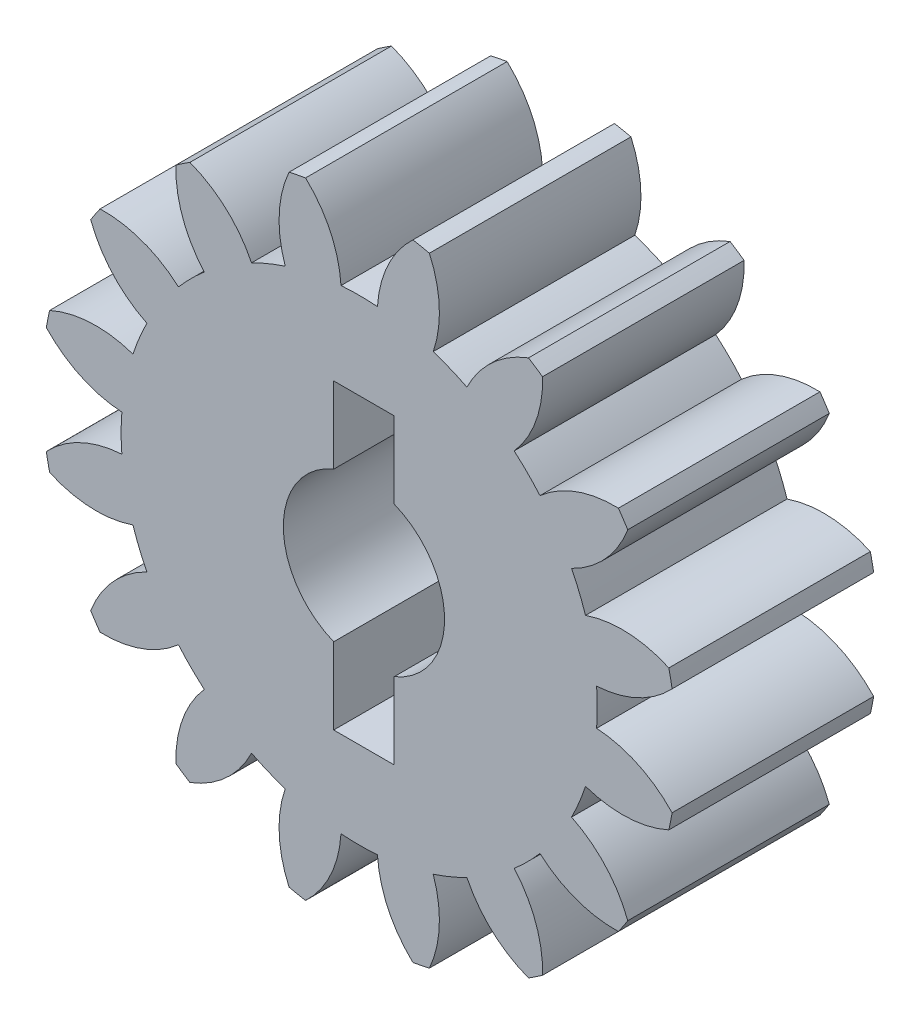
from build123d import *

# Parameters (mm, degrees)
BOSS_EXTRUDE1_DEPTH = 20


with BuildPart() as part:
    # Sketch1 → Boss-Extrude1 (new body)
    with BuildSketch(Plane.XY):
        with BuildLine():
            ThreePointArc((-31.51508502, 5.323636185), (-28.105369496, 2.849349951), (-24.022779405, 1.809777696))
            ThreePointArc((-24.022779405, 1.809777696), (-24.092202765, 0), (-24.022779405, -1.809777696))
            ThreePointArc((-24.022779405, -1.809777696), (-28.105369496, -2.849349951), (-31.51508502, -5.323636185))
            ThreePointArc((-31.51508502, -5.323636185), (-31.362939098, -6.145345144), (-31.189049197, -6.962728956))
            ThreePointArc((-31.189049197, -6.962728956), (-27.092014464, -7.943829725), (-22.92236596, -7.341929665))
            ThreePointArc((-22.92236596, -7.341929665), (-22.293932841, -9.040513406), (-21.537222079, -10.685962808))
            ThreePointArc((-21.537222079, -10.685962808), (-24.911216425, -13.208741926), (-27.114514461, -16.799525975))
            ThreePointArc((-27.114514461, -16.799525975), (-26.659495553, -17.50046234), (-26.186042989, -18.189081731))
            ThreePointArc((-26.186042989, -18.189081731), (-22.025425445, -17.527633336), (-18.403509716, -15.375894789))
            ThreePointArc((-18.403509716, -15.375894789), (-17.172893364, -16.704690599), (-15.844097554, -17.935306952))
            ThreePointArc((-15.844097554, -17.935306952), (-17.995836101, -21.55722268), (-18.657284496, -25.717840224))
            ThreePointArc((-18.657284496, -25.717840224), (-17.968665105, -26.191292788), (-17.26772874, -26.646311696))
            ThreePointArc((-17.26772874, -26.646311696), (-13.676944691, -24.44301366), (-11.154165573, -21.069019314))
            ThreePointArc((-11.154165573, -21.069019314), (-9.508716171, -21.825730076), (-7.81013243, -22.454163195))
            ThreePointArc((-7.81013243, -22.454163195), (-8.41203249, -26.623811699), (-7.430931721, -30.720846432))
            ThreePointArc((-7.430931721, -30.720846432), (-6.613547908, -30.894736333), (-5.79183895, -31.046882255))
            ThreePointArc((-5.79183895, -31.046882255), (-3.317552716, -27.637166731), (-2.277980461, -23.55457664))
            ThreePointArc((-2.277980461, -23.55457664), (-0.468202765, -23.624), (1.341574931, -23.55457664))
            ThreePointArc((1.341574931, -23.55457664), (2.381147186, -27.637166731), (4.85543342, -31.046882255))
            ThreePointArc((4.85543342, -31.046882255), (5.677142379, -30.894736333), (6.494526191, -30.720846432))
            ThreePointArc((6.494526191, -30.720846432), (7.47562696, -26.623811699), (6.8737269, -22.454163195))
            ThreePointArc((6.8737269, -22.454163195), (8.572310641, -21.825730076), (10.217760043, -21.069019314))
            ThreePointArc((10.217760043, -21.069019314), (12.740539161, -24.44301366), (16.33132321, -26.646311696))
            ThreePointArc((16.33132321, -26.646311696), (17.032259575, -26.191292788), (17.720878966, -25.717840224))
            ThreePointArc((17.720878966, -25.717840224), (17.059430571, -21.55722268), (14.907692024, -17.935306952))
            ThreePointArc((14.907692024, -17.935306952), (16.236487834, -16.704690599), (17.467104187, -15.375894789))
            ThreePointArc((17.467104187, -15.375894789), (21.089019915, -17.527633336), (25.249637459, -18.189081731))
            ThreePointArc((25.249637459, -18.189081731), (25.723090023, -17.50046234), (26.178108931, -16.799525975))
            ThreePointArc((26.178108931, -16.799525975), (23.974810895, -13.208741926), (20.600816549, -10.685962808))
            ThreePointArc((20.600816549, -10.685962808), (21.357527311, -9.040513406), (21.98596043, -7.341929665))
            ThreePointArc((21.98596043, -7.341929665), (26.155608934, -7.943829725), (30.252643667, -6.962728956))
            ThreePointArc((30.252643667, -6.962728956), (30.426533568, -6.145345144), (30.57867949, -5.323636185))
            ThreePointArc((30.57867949, -5.323636185), (27.168963966, -2.849349951), (23.086373875, -1.809777696))
            ThreePointArc((23.086373875, -1.809777696), (23.155797235, 0), (23.086373875, 1.809777696))
            ThreePointArc((23.086373875, 1.809777696), (27.168963966, 2.849349951), (30.57867949, 5.323636185))
            ThreePointArc((30.57867949, 5.323636185), (30.426533568, 6.145345144), (30.252643667, 6.962728956))
            ThreePointArc((30.252643667, 6.962728956), (26.155608934, 7.943829725), (21.98596043, 7.341929665))
            ThreePointArc((21.98596043, 7.341929665), (21.357527311, 9.040513406), (20.600816549, 10.685962808))
            ThreePointArc((20.600816549, 10.685962808), (23.974810895, 13.208741926), (26.178108931, 16.799525975))
            ThreePointArc((26.178108931, 16.799525975), (25.723090023, 17.50046234), (25.249637459, 18.189081731))
            ThreePointArc((25.249637459, 18.189081731), (21.089019915, 17.527633336), (17.467104187, 15.375894789))
            ThreePointArc((17.467104187, 15.375894789), (16.236487834, 16.704690599), (14.907692024, 17.935306952))
            ThreePointArc((14.907692024, 17.935306952), (17.059430571, 21.55722268), (17.720878966, 25.717840224))
            ThreePointArc((17.720878966, 25.717840224), (17.032259575, 26.191292788), (16.33132321, 26.646311696))
            ThreePointArc((16.33132321, 26.646311696), (12.740539161, 24.44301366), (10.217760043, 21.069019314))
            ThreePointArc((10.217760043, 21.069019314), (8.572310641, 21.825730076), (6.8737269, 22.454163195))
            ThreePointArc((6.8737269, 22.454163195), (7.47562696, 26.623811699), (6.494526191, 30.720846432))
            ThreePointArc((6.494526191, 30.720846432), (5.677142379, 30.894736333), (4.85543342, 31.046882255))
            ThreePointArc((4.85543342, 31.046882255), (2.381147186, 27.637166731), (1.341574931, 23.55457664))
            ThreePointArc((1.341574931, 23.55457664), (-0.468202765, 23.624), (-2.277980461, 23.55457664))
            ThreePointArc((-2.277980461, 23.55457664), (-3.317552716, 27.637166731), (-5.79183895, 31.046882255))
            ThreePointArc((-5.79183895, 31.046882255), (-6.613547908, 30.894736333), (-7.430931721, 30.720846432))
            ThreePointArc((-7.430931721, 30.720846432), (-8.41203249, 26.623811699), (-7.81013243, 22.454163195))
            ThreePointArc((-7.81013243, 22.454163195), (-9.508716171, 21.825730076), (-11.154165573, 21.069019314))
            ThreePointArc((-11.154165573, 21.069019314), (-13.676944691, 24.44301366), (-17.26772874, 26.646311696))
            ThreePointArc((-17.26772874, 26.646311696), (-17.968665105, 26.191292788), (-18.657284496, 25.717840224))
            ThreePointArc((-18.657284496, 25.717840224), (-17.995836101, 21.55722268), (-15.844097554, 17.935306952))
            ThreePointArc((-15.844097554, 17.935306952), (-17.172893364, 16.704690599), (-18.403509716, 15.375894789))
            ThreePointArc((-18.403509716, 15.375894789), (-22.025425445, 17.527633336), (-26.186042989, 18.189081731))
            ThreePointArc((-26.186042989, 18.189081731), (-26.659495553, 17.50046234), (-27.114514461, 16.799525975))
            ThreePointArc((-27.114514461, 16.799525975), (-24.911216425, 13.208741926), (-21.537222079, 10.685962808))
            ThreePointArc((-21.537222079, 10.685962808), (-22.293932841, 9.040513406), (-22.92236596, 7.341929665))
            ThreePointArc((-22.92236596, 7.341929665), (-27.092014464, 7.943829725), (-31.189049197, 6.962728956))
            ThreePointArc((-31.189049197, 6.962728956), (-31.362939098, 6.145345144), (-31.51508502, 5.323636185))
        make_face()
        with BuildLine():
            Line((-3, 15), (3, 15))
            Line((3, 15), (3, 7.416198487))
            ThreePointArc((3, 7.416198487), (8, 0), (3, -7.416198487))
            Line((3, -7.416198487), (3, -15))
            Line((3, -15), (-3, -15))
            Line((-3, -15), (-3, -7.416198487))
            ThreePointArc((-3, -7.416198487), (-8, 0), (-3, 7.416198487))
            Line((-3, 7.416198487), (-3, 15))
        make_face(mode=Mode.SUBTRACT)
    extrude(amount=BOSS_EXTRUDE1_DEPTH)


solid = part.part
